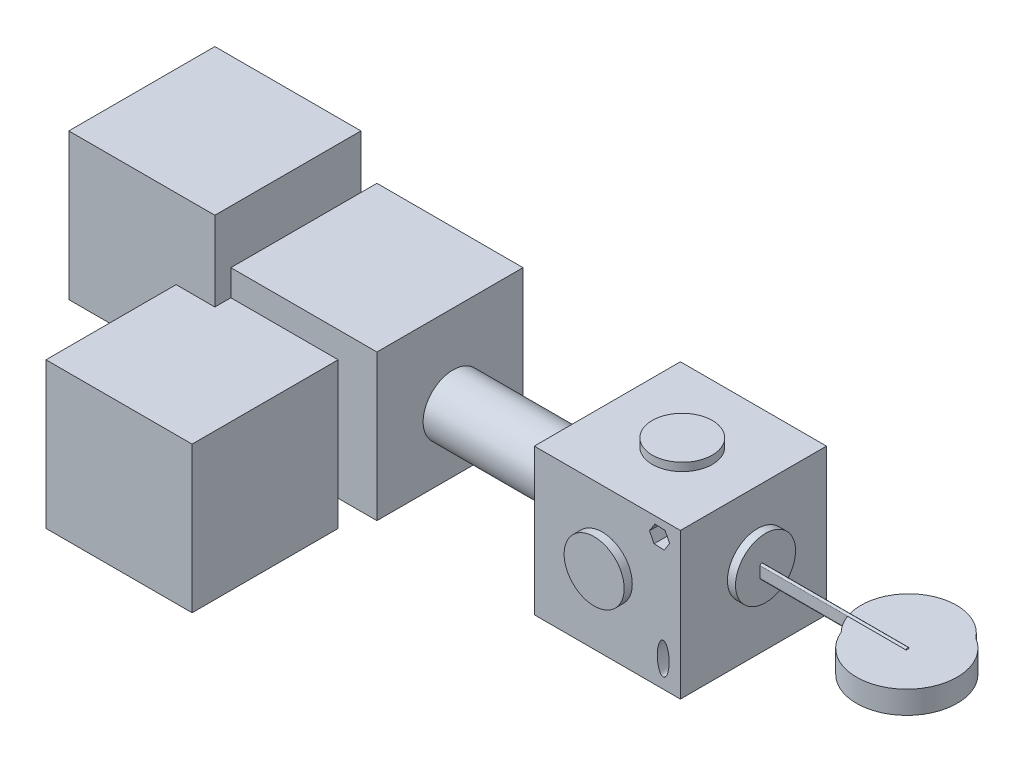
from build123d import *

# Parameters (mm, degrees)
SKETCH1_W                = 90
SKETCH1_H                = 90
BOSS_EXTRUDE1_DEPTH      = 90
BOSS_EXTRUDE2_DEPTH      = 5
BOSS_EXTRUDE2_DEPTH_BACK = 90
SKETCH2_R                = 18.495149705
BOSS_EXTRUDE3_DEPTH      = 5
BOSS_EXTRUDE3_DEPTH_BACK = 90
SKETCH3_R                = 18.495149705
BOSS_EXTRUDE4_DEPTH      = 5
BOSS_EXTRUDE4_DEPTH_BACK = 90
SKETCH4_R                = 18.495149705
BOSS_EXTRUDE5_DEPTH      = 95.671853643
BOSS_EXTRUDE5_DEPTH_BACK = 90
SKETCH5_R                = 18.495149705
BOSS_EXTRUDE6_DEPTH      = 5
BOSS_EXTRUDE6_DEPTH_BACK = 90
SKETCH6_R                = 18.495149705
CUT_EXTRUDE1_DEPTH       = 90
SKETCH8_RX               = 9.776430477
SKETCH8_RY               = 3.640340221
CUT_EXTRUDE2_DEPTH       = 90
BOSS_EXTRUDE7_DEPTH      = 90
SKETCH10_R               = 29.435529535
SKETCH10_R_2             = 31.00879633
BOSS_EXTRUDE10_DEPTH     = 14
SKETCH11_W               = 90
SKETCH11_H               = 90
BOSS_EXTRUDE11_DEPTH     = 90
SKETCH14_W               = 90
SKETCH14_H               = 90
BOSS_EXTRUDE12_DEPTH     = 90
SKETCH15_W               = 90
SKETCH15_H               = 90
BOSS_EXTRUDE13_DEPTH     = 90


with BuildPart() as part:
    # Sketch1 → Boss-Extrude1 (new body)
    with BuildSketch(Plane.XY):
        Rectangle(SKETCH1_W, SKETCH1_H)
    extrude(amount=BOSS_EXTRUDE1_DEPTH)

    # Sketch2 → Boss-Extrude2 (add, two sides: drawn at the far end of the back side and taken through both)
    with BuildSketch(Plane(origin=(45, 0, 0), x_dir=(0, 0, -1), z_dir=(1, 0, 0)).offset(-BOSS_EXTRUDE2_DEPTH_BACK)):
        with Locations(Location((-42.533520746, 3.735944486, 0), (0, 0, 270))):
            Circle(SKETCH2_R)
    extrude(amount=BOSS_EXTRUDE2_DEPTH + BOSS_EXTRUDE2_DEPTH_BACK)

    # Sketch3 → Boss-Extrude3 (add, two sides: drawn at the far end of the back side and taken through both)
    with BuildSketch(Plane.XY.offset(90).offset(-BOSS_EXTRUDE3_DEPTH_BACK)):
        with Locations((-3.126781539, 1.624320901)):
            Circle(SKETCH3_R)
    extrude(amount=BOSS_EXTRUDE3_DEPTH + BOSS_EXTRUDE3_DEPTH_BACK)

    # Sketch4 → Boss-Extrude4 (add, two sides: drawn at the far end of the back side and taken through both)
    with BuildSketch(Plane(origin=(0, 45, 0), x_dir=(0, 0, -1), z_dir=(0, 1, 0)).offset(-BOSS_EXTRUDE4_DEPTH_BACK)):
        with Locations((-44.963029761, -1.140691585)):
            Circle(SKETCH4_R)
    extrude(amount=BOSS_EXTRUDE4_DEPTH + BOSS_EXTRUDE4_DEPTH_BACK)

    # Sketch5 → Boss-Extrude5 (add, two sides: drawn at the far end of the back side and taken through both)
    with BuildSketch(Plane.ZY.offset(45).offset(-BOSS_EXTRUDE5_DEPTH_BACK)):
        with Locations(Location((44.323215706, -3.480744369, 0), (0, 0, 90))):
            Circle(SKETCH5_R)
    extrude(amount=BOSS_EXTRUDE5_DEPTH + BOSS_EXTRUDE5_DEPTH_BACK)

    # Sketch6 → Boss-Extrude6 (add, two sides: drawn at the far end of the back side and taken through both)
    with BuildSketch(Plane(origin=(0, -45, 0), x_dir=(0, 0, -1), z_dir=(0, -1, 0)).offset(-BOSS_EXTRUDE6_DEPTH_BACK)):
        with Locations(Location((-43.114009277, -1.073204684, 0), (0, 0, 180))):
            Circle(SKETCH6_R)
    extrude(amount=BOSS_EXTRUDE6_DEPTH + BOSS_EXTRUDE6_DEPTH_BACK)

    # Sketch7 → Cut-Extrude1 (cut)
    with BuildSketch(Plane(origin=(0, 0, 0), x_dir=(-1, 0, 0), z_dir=(0, 0, -1))):
        Polygon((-28.802165797, 29.805616158), (-25.949050166, 35.352304143), (-29.326065052, 40.596518751), (-35.556195569, 40.294045375), (-38.4093112, 34.747357391), (-35.032296314, 29.503142782), align=None)
    extrude(amount=-CUT_EXTRUDE1_DEPTH, mode=Mode.SUBTRACT)

    # Sketch8 → Cut-Extrude2 (cut)
    with BuildSketch(Plane.XY.offset(90)):
        with Locations(Location((34.417640855, -28.6823815), (0, 0, -90))):
            Ellipse(SKETCH8_RX, SKETCH8_RY)
    extrude(amount=-CUT_EXTRUDE2_DEPTH, mode=Mode.SUBTRACT)

    # Sketch9 → Boss-Extrude7 (add)
    with BuildSketch(Plane(origin=(50, 0, 0), x_dir=(0, 0, -1), z_dir=(1, 0, 0))):
        with BuildLine():
            Line((-44.073528041, 6.623037359), (-44.073528041, 0))
            ThreePointArc((-44.073528041, 0), (-44.987170795, -0.913642754), (-45.900813549, 0))
            Line((-45.900813549, 0), (-45.900813549, 6.623037359))
            ThreePointArc((-45.900813549, 6.623037359), (-44.987170795, 7.536680113), (-44.073528041, 6.623037359))
        make_face()
    extrude(amount=BOSS_EXTRUDE7_DEPTH)

    # Sketch10 → Boss-Extrude10 (add)
    with BuildSketch(Plane(origin=(140, 6.623037359, 44.073528041), x_dir=(1, 0, 0), z_dir=(0, 1, 0))):
        with Locations((-8.425763271, 8.188123623)):
            Circle(SKETCH10_R)
        with Locations((-0.853882083, -0.578401306)):
            Circle(SKETCH10_R_2)
    extrude(amount=-BOSS_EXTRUDE10_DEPTH)

    # Sketch11 → Boss-Extrude11 (add)
    with BuildSketch(Plane.ZY.offset(140.671853643)):
        with Locations((46.274660301, 3.007862201)):
            Rectangle(SKETCH11_W, SKETCH11_H)
    extrude(amount=BOSS_EXTRUDE11_DEPTH)

    # Sketch14 → Boss-Extrude12 (add)
    with BuildSketch(Plane.XY.offset(91.274660301)):
        with Locations((-209.537955893, -13.069417981)):
            Rectangle(SKETCH14_W, SKETCH14_H)
    extrude(amount=BOSS_EXTRUDE12_DEPTH)

    # Sketch15 → Boss-Extrude13 (add)
    with BuildSketch(Plane.ZY.offset(230.671853643)):
        with Locations((56.117901354, 35.887776579)):
            Rectangle(SKETCH15_W, SKETCH15_H)
    extrude(amount=BOSS_EXTRUDE13_DEPTH)


solid = part.part
